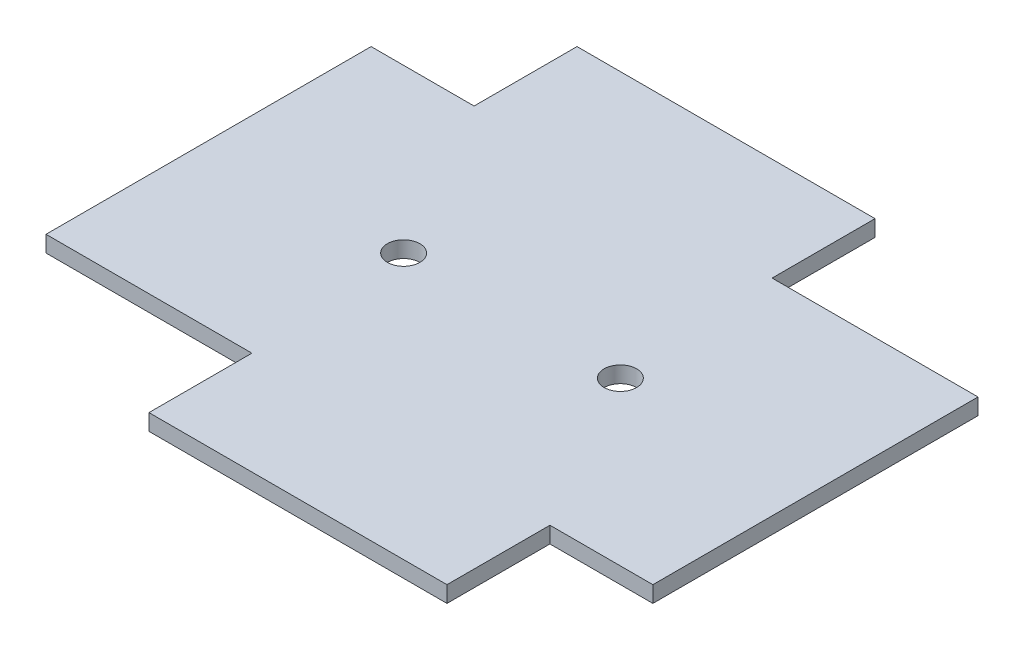
from build123d import *

# Parameters (mm, degrees)
SKETCH_1_R      = 1.5
EXTRUDE_1_DEPTH = 1.5


with BuildPart() as part:
    # Эскиз1 → Бобышка-Вытянуть1 (new body)
    with BuildSketch(Plane(origin=(0, 0, 0), x_dir=(1, 0, 0), z_dir=(0, 1, 0))):
        Polygon((-28, 15), (-28, -15), (-9, -15), (-9, -24.5), (18.5, -24.5), (18.5, -15), (28, -15), (28, 15), (9, 15), (9, 24.5), (-18.5, 24.5), (-18.5, 15), align=None)
        with Locations(Location((-10, 0, 0), (0, 0, 270))):
            Circle(SKETCH_1_R, mode=Mode.SUBTRACT)
        with Locations(Location((10, 0, 0), (0, 0, 270))):
            Circle(SKETCH_1_R, mode=Mode.SUBTRACT)
    extrude(amount=EXTRUDE_1_DEPTH)


solid = part.part
